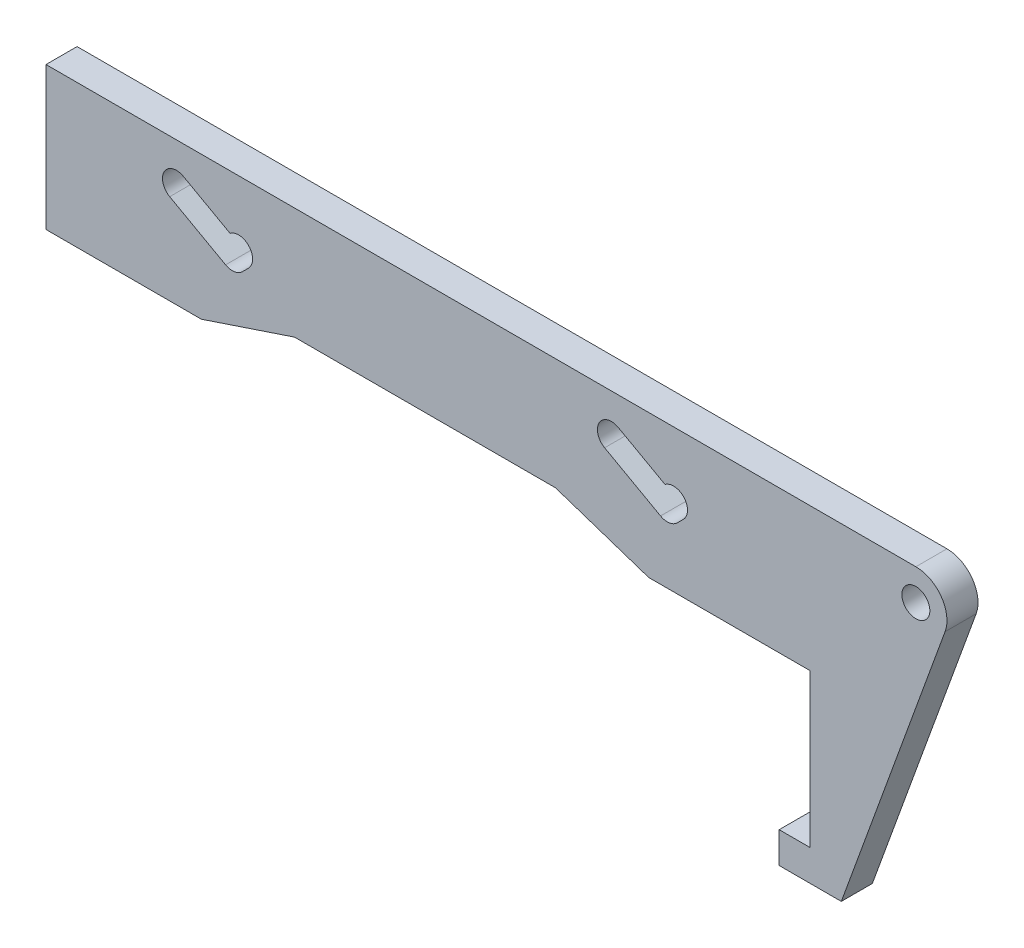
from build123d import *

# Parameters (mm, degrees)
SKETCH1_W           = 16
SKETCH1_H           = 5
BOSS_EXTRUDE1_DEPTH = 5
SKETCH2_W           = 42
SKETCH2_H           = 5
CUT_EXTRUDE1_DEPTH  = 5
SKETCH3_R           = 5
SKETCH3_R_2         = 2.25
BOSS_EXTRUDE2_DEPTH = 5


with BuildPart() as part:
    # Sketch1 → Boss-Extrude1 (new body)
    with BuildSketch(Plane.XY):
        with BuildLine():
            Line((-41.677050983, 9), (-45, 9))
            Line((-45, 9), (-61, 9))
            Line((-61, 9), (-61, -9))
            Line((-61, -9), (61, -9))
            Line((61, -9), (61, 9))
            Line((61, 9), (45, 9))
            Line((45, 9), (31.933033563, 9))
            Line((31.933033563, 9), (38.62595316, 5.281711335))
            ThreePointArc((38.62595316, 5.281711335), (40.992696986, 5.519171289), (42.25, 3.5))
            ThreePointArc((42.25, 3.5), (42.078728948, 2.638962277), (41.590990258, 1.909009742))
            Line((41.590990258, 1.909009742), (40.590990258, 0.909009742))
            ThreePointArc((40.590990258, 0.909009742), (39.312077727, 0.271747884), (37.907303405, 0.533146129))
            Line((37.907303405, 0.533146129), (28.907303405, 5.533146129))
            ThreePointArc((28.907303405, 5.533146129), (27.781296696, 7.126027211), (28.322949017, 9))
            Line((28.322949017, 9), (-38.066966437, 9))
            Line((-38.066966437, 9), (-31.37404684, 5.281711335))
            ThreePointArc((-31.37404684, 5.281711335), (-29.007303014, 5.519171289), (-27.75, 3.5))
            ThreePointArc((-27.75, 3.5), (-27.921271052, 2.638962277), (-28.409009742, 1.909009742))
            Line((-28.409009742, 1.909009742), (-29.409009742, 0.909009742))
            ThreePointArc((-29.409009742, 0.909009742), (-30.687922273, 0.271747884), (-32.092696595, 0.533146129))
            Line((-32.092696595, 0.533146129), (-41.092696595, 5.533146129))
            ThreePointArc((-41.092696595, 5.533146129), (-42.218703304, 7.126027211), (-41.677050983, 9))
        make_face()
        with BuildLine():
            Line((45, 14), (-45, 14))
            Line((-45, 14), (-45, 9))
            Line((-45, 9), (-41.677050983, 9))
            ThreePointArc((-41.677050983, 9), (-40.373972789, 9.718703304), (-38.907303405, 9.466853871))
            Line((-38.907303405, 9.466853871), (-38.066966437, 9))
            Line((-38.066966437, 9), (28.322949017, 9))
            ThreePointArc((28.322949017, 9), (29.626027211, 9.718703304), (31.092696595, 9.466853871))
            Line((31.092696595, 9.466853871), (31.933033563, 9))
            Line((31.933033563, 9), (45, 9))
            Line((45, 9), (45, 14))
        make_face()
        with Locations((-53, 11.5)):
            Rectangle(SKETCH1_W, SKETCH1_H)
        with Locations((53, 11.5)):
            Rectangle(SKETCH1_W, SKETCH1_H)
    extrude(amount=BOSS_EXTRUDE1_DEPTH)

    # Sketch2 → Cut-Extrude1 (cut)
    with BuildSketch(Plane.XY.offset(5)):
        Polygon((-36, -9), (-21, -9), (-21, -4), align=None)
        with Locations((0, -6.5)):
            Rectangle(SKETCH2_W, SKETCH2_H)
        Polygon((21, -4), (21, -9), (36, -9), align=None)
    extrude(amount=-CUT_EXTRUDE1_DEPTH, mode=Mode.SUBTRACT)

    # Sketch3 → Boss-Extrude2 (add)
    # profile 1 of 2: a face of its own
    with BuildSketch(Plane.XY.offset(5)):
        with Locations((79, 9)):
            Circle(SKETCH3_R)
        with Locations((79, 9)):
            Circle(SKETCH3_R_2, mode=Mode.SUBTRACT)
    # profile 2 of 2: a face of its own
    with BuildSketch(Plane.XY.offset(5)):
        with BuildLine():
            Line((79, 14), (61, 14))
            Line((61, 14), (61, -9))
            Line((61, -9), (62, -9))
            Line((62, -9), (62, -33.65))
            Line((62, -33.65), (57, -33.65))
            Line((57, -33.65), (57, -38.65))
            Line((57, -38.65), (67, -38.65))
            Line((67, -38.65), (83.699195541, 7.29191298))
            ThreePointArc((83.699195541, 7.29191298), (74.904854392, 6.131240259), (79, 14))
        make_face()
    extrude(amount=-BOSS_EXTRUDE2_DEPTH)


solid = part.part
